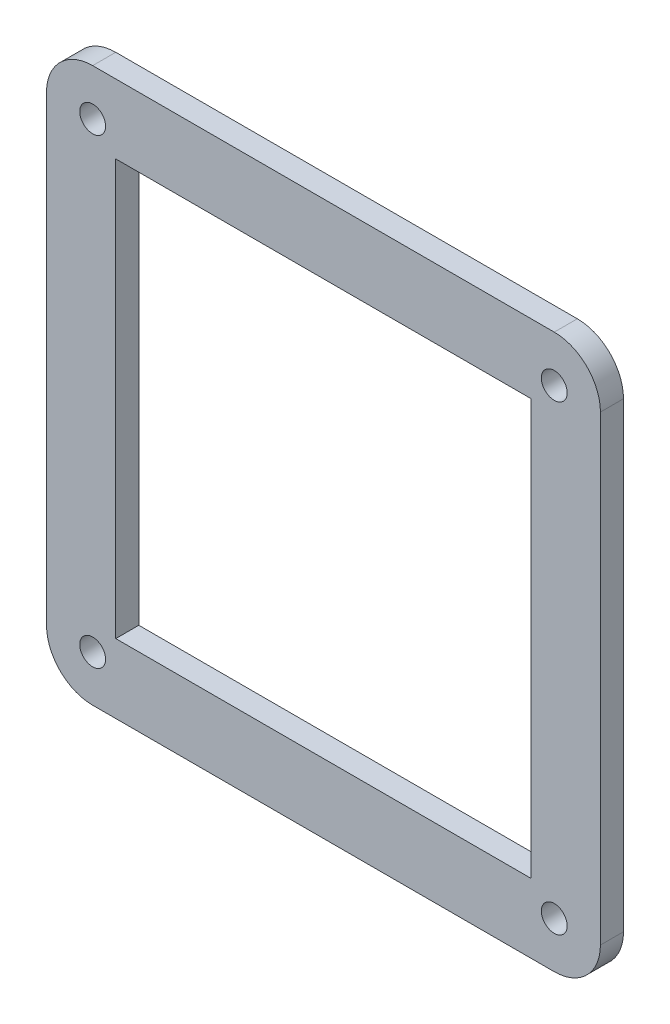
from build123d import *

# Parameters (mm, degrees)
SKETCH1_R           = 2.8
SKETCH1_W           = 90
SKETCH1_H           = 90
BOSS_EXTRUDE1_DEPTH = 5


with BuildPart() as part:
    # Sketch1 → Boss-Extrude1 (new body)
    with BuildSketch(Plane(origin=(0, 0, 0), x_dir=(-1, 0, 0), z_dir=(0, 0, -1))):
        with BuildLine():
            Line((60, -50), (60, 50))
            ThreePointArc((60, 50), (57.071067812, 57.071067812), (50, 60))
            Line((50, 60), (-50, 60))
            ThreePointArc((-50, 60), (-57.071067812, 57.071067812), (-60, 50))
            Line((-60, 50), (-60, -50))
            ThreePointArc((-60, -50), (-57.071067812, -57.071067812), (-50, -60))
            Line((-50, -60), (50, -60))
            ThreePointArc((50, -60), (57.071067812, -57.071067812), (60, -50))
        make_face()
        with Locations(Location((50, -50, 0), (0, 0, 180))):
            Circle(SKETCH1_R, mode=Mode.SUBTRACT)
        with Locations(Location((-50, -50, 0), (0, 0, 180))):
            Circle(SKETCH1_R, mode=Mode.SUBTRACT)
        with Locations(Location((-50, 50, 0), (0, 0, 180))):
            Circle(SKETCH1_R, mode=Mode.SUBTRACT)
        with Locations(Location((50, 50, 0), (0, 0, 180))):
            Circle(SKETCH1_R, mode=Mode.SUBTRACT)
        Rectangle(SKETCH1_W, SKETCH1_H, mode=Mode.SUBTRACT)
    extrude(amount=-BOSS_EXTRUDE1_DEPTH)


solid = part.part
